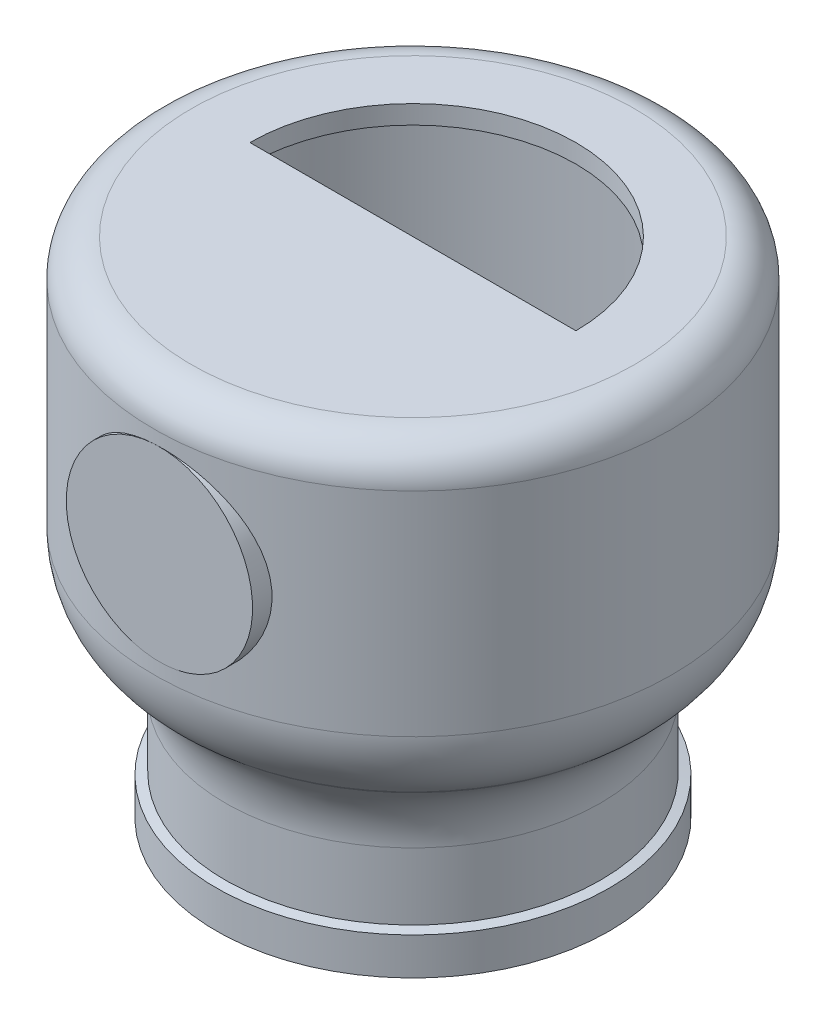
from build123d import *
from build123d.topology import SkipClean

# Parameters (mm, degrees)
CUT_EXTRUDE2_DEPTH  = 40
SKETCH10_R          = 10
BOSS_EXTRUDE1_DEPTH = 5


with BuildPart() as part:
    # Sketch1 → Revolve1 (revolve)
    with BuildSketch(Plane.XY):
        with BuildLine():
            Line((20.9, 0), (23.871591838, 0))
            Line((23.871591838, 0), (23.871591838, 4))
            Line((23.871591838, 4), (22.9, 4.236662843))
            Line((22.9, 4.236662843), (22.9, 11.404308102))
            ThreePointArc((22.9, 11.404308102), (23.83692213, 15.63049072), (26.472123903, 19.064752533))
            Line((26.472123903, 19.064752533), (26.988320528, 19.497892931))
            ThreePointArc((26.988320528, 19.497892931), (29.623522302, 22.932154745), (30.560444431, 27.158337362))
            Line((30.560444431, 27.158337362), (30.560444431, 50))
            ThreePointArc((30.560444431, 50), (29.388871556, 52.828427125), (26.560444431, 54))
            Line((26.560444431, 54), (2.764914955, 54))
            Line((2.764914955, 54), (2.764914955, 52))
            Line((2.764914955, 52), (26.560444431, 52))
            ThreePointArc((26.560444431, 52), (27.974657994, 51.414213562), (28.560444431, 50))
            Line((28.560444431, 50), (28.560444431, 28.090952678))
            ThreePointArc((28.560444431, 28.090952678), (27.623522302, 23.864770061), (24.988320528, 20.430508247))
            Line((24.988320528, 20.430508247), (23.688173754, 19.339555569))
            ThreePointArc((23.688173754, 19.339555569), (20.680499091, 17.603073792), (17.260297657, 17))
            Line((17.260297657, 17), (2.764914955, 17))
            Line((2.764914955, 17), (2.764914955, 15))
            Line((2.764914955, 15), (19.9, 15))
            ThreePointArc((19.9, 15), (20.607106781, 14.707106781), (20.9, 14))
            Line((20.9, 14), (20.9, 0))
        make_face()
    revolve(axis=Axis((2.764914955, 7.821821657, 0), (0, 1, 0)))

    # Sketch9 → Cut-Extrude2 (cut)
    with BuildSketch(Plane(origin=(0, 54, 0), x_dir=(1, 0, 0), z_dir=(0, 1, 0))):
        with BuildLine():
            Line((-14.735084994, -0.001327718), (20.264915006, -0.001327718))
            ThreePointArc((20.264915006, -0.001327718), (2.764915006, 17.498672282), (-14.735084994, -0.001327718))
        make_face()
    extrude(amount=-CUT_EXTRUDE2_DEPTH, mode=Mode.SUBTRACT)

    # Sketch10 → Boss-Extrude1 (add)
    with SkipClean():  # the faces are left unmerged after this step: merging them gives an invalid solid
        with BuildSketch(Plane.XY.offset(27.795529476)):
            with Locations((3.346345887, 38.658337362)):
                Circle(SKETCH10_R)
        extrude(amount=-BOSS_EXTRUDE1_DEPTH)


solid = part.part
